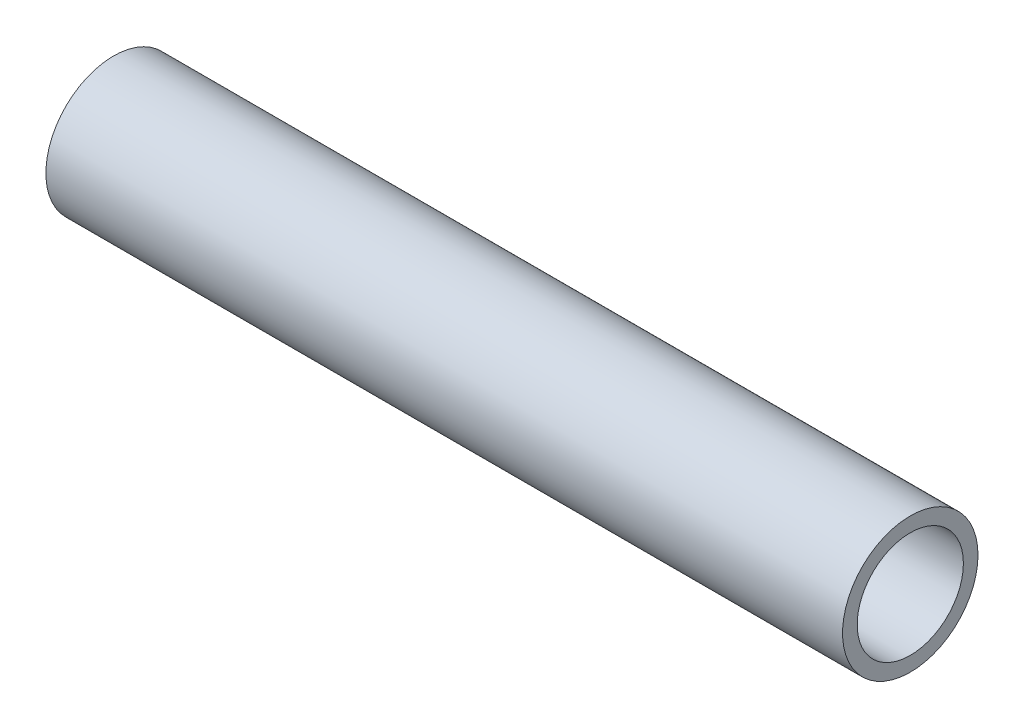
from build123d import *

# Parameters (mm, degrees)
SKETCH1_R           = 5.1
SKETCH1_R_2         = 4
BOSS_EXTRUDE1_DEPTH = 60


with BuildPart() as part:
    # Sketch1 → Boss-Extrude1 (new body)
    with BuildSketch(Plane(origin=(0, 0, 0), x_dir=(0, 0, -1), z_dir=(1, 0, 0))):
        Circle(SKETCH1_R)
        Circle(SKETCH1_R_2, mode=Mode.SUBTRACT)
    extrude(amount=BOSS_EXTRUDE1_DEPTH)


solid = part.part
